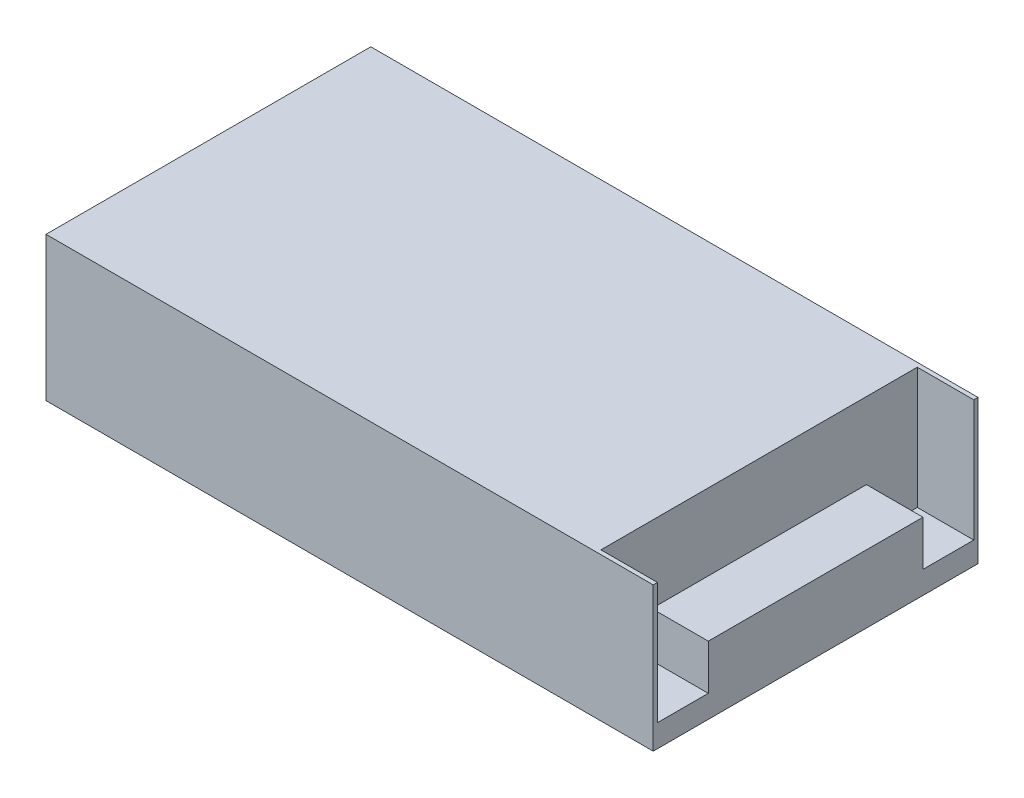
from build123d import *

# Parameters (mm, degrees)
SKETCH_1_W          = 215
SKETCH_1_H          = 115
EXTRUDE_1_DEPTH     = 51
CUT_EXTRUDE_1_DEPTH = 20


with BuildPart() as part:
    # Эскиз1 → Бобышка-Вытянуть1 (new body)
    with BuildSketch(Plane(origin=(0, 0, 0), x_dir=(1, 0, 0), z_dir=(0, 1, 0))):
        Rectangle(SKETCH_1_W, SKETCH_1_H)
    extrude(amount=EXTRUDE_1_DEPTH)

    # Эскиз3 → Вырез-Вытянуть1 (cut)
    with BuildSketch(Plane(origin=(107.5, 0, 0), x_dir=(0, 0, -1), z_dir=(1, 0, 0))):
        Polygon((-56, 51), (56, 51), (56, 24), (56, 8), (38, 8), (38, 24), (-38, 24), (-38, 8), (-56, 8), (-56, 24), align=None)
    extrude(amount=-CUT_EXTRUDE_1_DEPTH, mode=Mode.SUBTRACT)


solid = part.part
